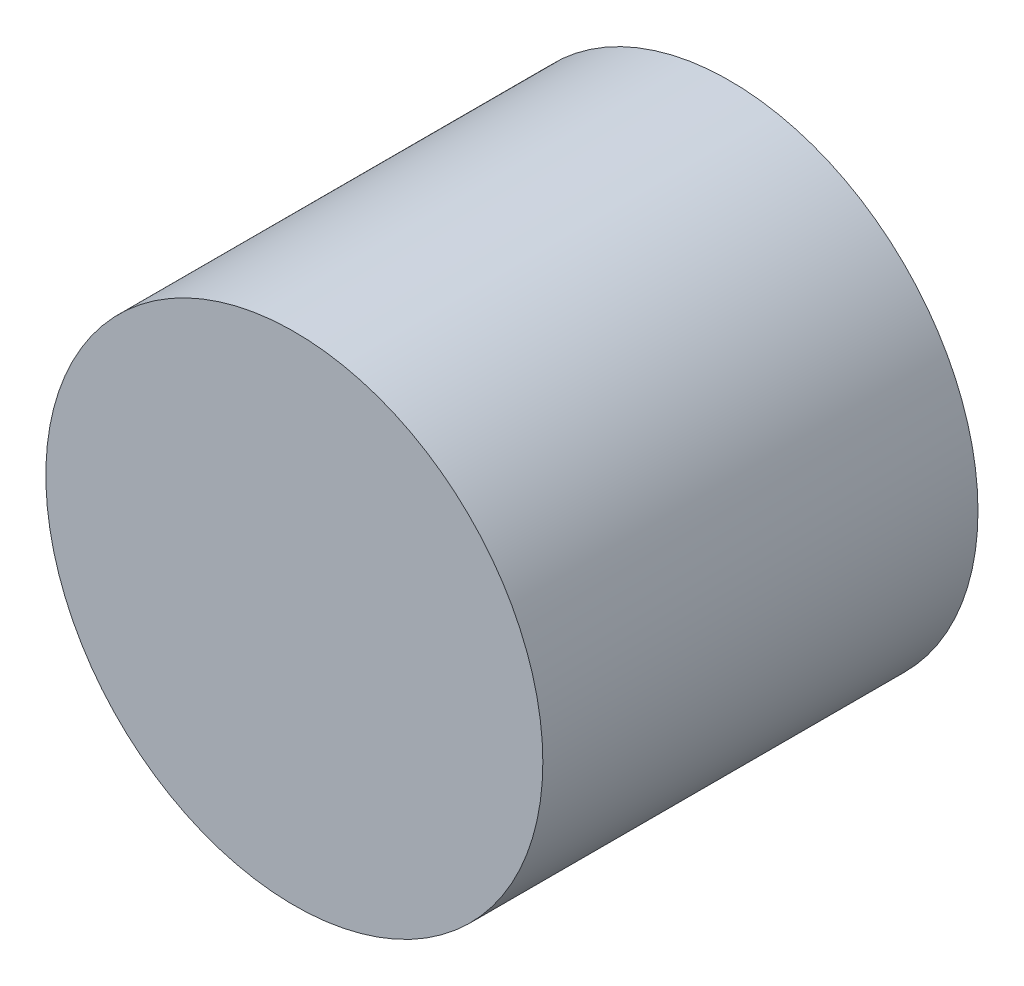
from build123d import *

# Parameters (mm, degrees)
SKETCH1_R      = 7.995
EXTRUDE1_DEPTH = 14


with BuildPart() as part:
    # Sketch1 → Extrude1 (new body)
    with BuildSketch(Plane.XY):
        Circle(SKETCH1_R)
    extrude(amount=EXTRUDE1_DEPTH)


solid = part.part
